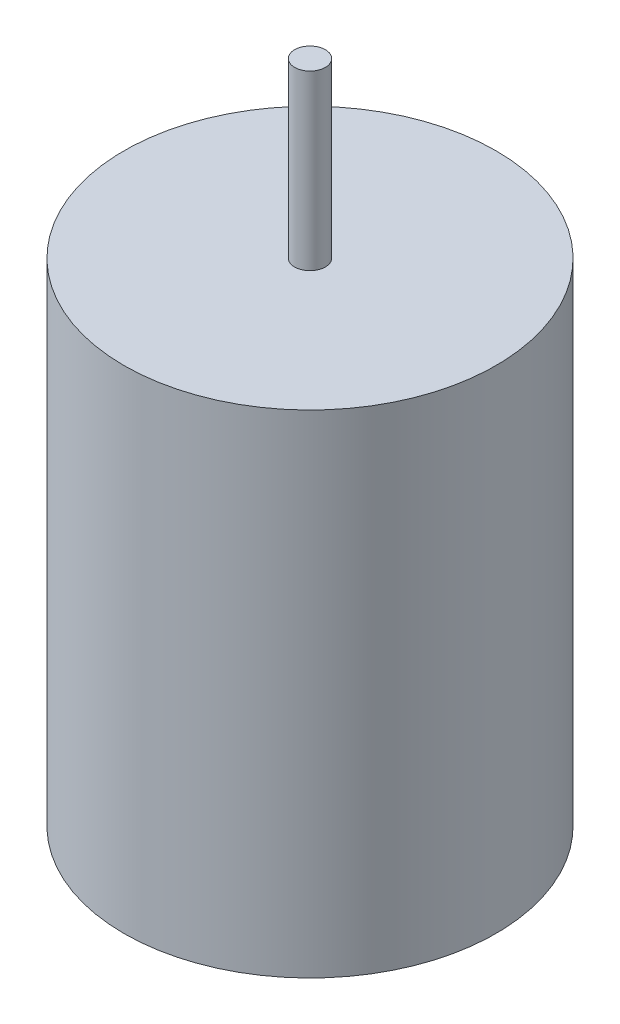
from build123d import *

# Parameters (mm, degrees)
SKETCH1_R           = 13.9954
BOSS_EXTRUDE1_DEPTH = 37.0078
SKETCH2_R           = 1.1557
BOSS_EXTRUDE2_DEPTH = 13.0048


with BuildPart() as part:
    # Sketch1 → Boss-Extrude1 (new body)
    with BuildSketch(Plane(origin=(0, 0, 0), x_dir=(1, 0, 0), z_dir=(0, 1, 0))):
        with Locations(Location((0, 0, 0), (0, 0, 270))):
            Circle(SKETCH1_R)
    extrude(amount=BOSS_EXTRUDE1_DEPTH)

    # Sketch2 → Boss-Extrude2 (add)
    with BuildSketch(Plane(origin=(0, 37.0078, 0), x_dir=(1, 0, 0), z_dir=(0, 1, 0))):
        with Locations(Location((0, 0, 0), (0, 0, 270))):
            Circle(SKETCH2_R)
    extrude(amount=BOSS_EXTRUDE2_DEPTH)


solid = part.part
